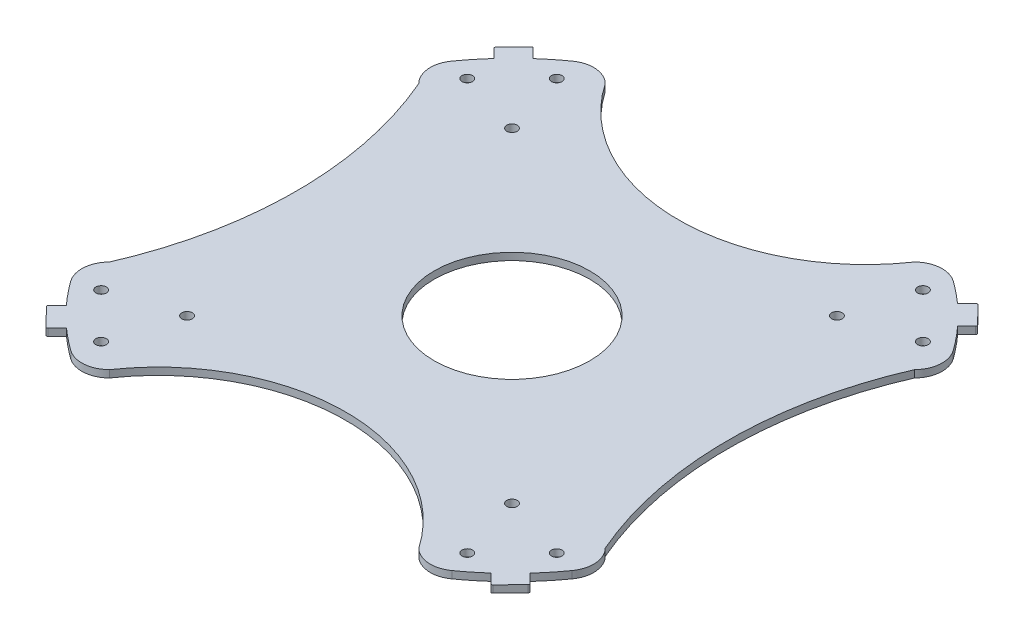
from build123d import *

# Parameters (mm, degrees)
SKETCH1_R           = 1.015999988
SKETCH1_R_2         = 15
BOSS_EXTRUDE1_DEPTH = 1.397


with BuildPart() as part:
    # Sketch1 → Boss-Extrude1 (new body)
    with BuildSketch(Plane(origin=(0, 0, 0), x_dir=(1, 0, 0), z_dir=(0, 1, 0))):
        with BuildLine():
            Line((-44.657487237, -41.209177315), (-46.396043567, -42.947733627))
            ThreePointArc((-46.396043567, -42.947733627), (-46.470434262, -43.125880964), (-46.398093323, -43.304870453))
            Line((-46.398093323, -43.304870453), (-43.050556802, -46.730153525))
            ThreePointArc((-43.050556802, -46.730153525), (-42.865374815, -46.831022568), (-42.667823867, -46.757262447))
            Line((-42.667823867, -46.757262447), (-40.871772634, -44.961211232))
            ThreePointArc((-40.871772634, -44.961211232), (-38.831009245, -46.687575098), (-36.702263685, -48.30420423))
            ThreePointArc((-36.702263685, -48.30420423), (-33.138347002, -49.294565873), (-29.78114627, -47.741658512))
            ThreePointArc((-29.78114627, -47.741658512), (0, -32.054645119), (29.78114627, -47.741658512))
            ThreePointArc((29.78114627, -47.741658512), (33.138347002, -49.294565873), (36.702263685, -48.30420423))
            ThreePointArc((36.702263685, -48.30420423), (38.831009245, -46.687575098), (40.871772634, -44.961211232))
            Line((40.871772634, -44.961211232), (42.667823867, -46.757262447))
            ThreePointArc((42.667823867, -46.757262447), (42.865374815, -46.831022568), (43.050556802, -46.730153525))
            Line((43.050556802, -46.730153525), (46.398093323, -43.304870453))
            ThreePointArc((46.398093323, -43.304870453), (46.470434262, -43.125880964), (46.396043567, -42.947733627))
            Line((46.396043567, -42.947733627), (44.657487237, -41.209177315))
            ThreePointArc((44.657487237, -41.209177315), (46.545191357, -39.007785017), (48.30420423, -36.702263685))
            ThreePointArc((48.30420423, -36.702263685), (49.294565905, -33.13834702), (47.741658512, -29.78114627))
            ThreePointArc((47.741658512, -29.78114627), (41.575395348, 0), (47.741658512, 29.78114627))
            ThreePointArc((47.741658512, 29.78114627), (49.294565905, 33.13834702), (48.30420423, 36.702263685))
            ThreePointArc((48.30420423, 36.702263685), (46.545191357, 39.007785017), (44.657487237, 41.209177315))
            Line((44.657487237, 41.209177315), (46.396043567, 42.947733627))
            ThreePointArc((46.396043567, 42.947733627), (46.470434262, 43.125880964), (46.398093323, 43.304870453))
            Line((46.398093323, 43.304870453), (43.050556802, 46.730153525))
            ThreePointArc((43.050556802, 46.730153525), (42.865374815, 46.831022568), (42.667823867, 46.757262447))
            Line((42.667823867, 46.757262447), (40.871772634, 44.961211232))
            ThreePointArc((40.871772634, 44.961211232), (38.831009245, 46.687575098), (36.702263685, 48.30420423))
            ThreePointArc((36.702263685, 48.30420423), (33.138347002, 49.294565873), (29.78114627, 47.741658512))
            ThreePointArc((29.78114627, 47.741658512), (0, 32.054645119), (-29.78114627, 47.741658512))
            ThreePointArc((-29.78114627, 47.741658512), (-33.138347002, 49.294565873), (-36.702263685, 48.30420423))
            ThreePointArc((-36.702263685, 48.30420423), (-38.831009245, 46.687575098), (-40.871772634, 44.961211232))
            Line((-40.871772634, 44.961211232), (-42.667823867, 46.757262447))
            ThreePointArc((-42.667823867, 46.757262447), (-42.865374815, 46.831022568), (-43.050556802, 46.730153525))
            Line((-43.050556802, 46.730153525), (-46.398093323, 43.304870453))
            ThreePointArc((-46.398093323, 43.304870453), (-46.470434262, 43.125880964), (-46.396043567, 42.947733627))
            Line((-46.396043567, 42.947733627), (-44.657487237, 41.209177315))
            ThreePointArc((-44.657487237, 41.209177315), (-46.545191357, 39.007785017), (-48.30420423, 36.702263685))
            ThreePointArc((-48.30420423, 36.702263685), (-49.294565905, 33.13834702), (-47.741658512, 29.78114627))
            ThreePointArc((-47.741658512, 29.78114627), (-41.575395348, 0), (-47.741658512, -29.78114627))
            ThreePointArc((-47.741658512, -29.78114627), (-49.294565905, -33.13834702), (-48.30420423, -36.702263685))
            ThreePointArc((-48.30420423, -36.702263685), (-46.545191357, -39.007785017), (-44.657487237, -41.209177315))
        make_face()
        with Locations(Location((-35.273880272, -43.89492624, 0), (0, 0, 90))):
            Circle(SKETCH1_R, mode=Mode.SUBTRACT)
        with Locations(Location((-43.894926149, -35.273880364, 0), (0, 0, 270))):
            Circle(SKETCH1_R, mode=Mode.SUBTRACT)
        with Locations(Location((-31.299173944, -31.299174035, 0), (0, 0, 270))):
            Circle(SKETCH1_R, mode=Mode.SUBTRACT)
        with Locations(Location((43.894926149, -35.273880364, 0), (0, 0, 90))):
            Circle(SKETCH1_R, mode=Mode.SUBTRACT)
        with Locations(Location((35.273880272, -43.89492624, 0), (0, 0, 270))):
            Circle(SKETCH1_R, mode=Mode.SUBTRACT)
        with Locations(Location((31.299173944, -31.299174035, 0), (0, 0, 90))):
            Circle(SKETCH1_R, mode=Mode.SUBTRACT)
        with Locations(Location((-35.273880272, 43.89492624, 0), (0, 0, 270))):
            Circle(SKETCH1_R, mode=Mode.SUBTRACT)
        with Locations(Location((-31.299173944, 31.299174035, 0), (0, 0, 90))):
            Circle(SKETCH1_R, mode=Mode.SUBTRACT)
        with Locations(Location((-43.894926149, 35.273880364, 0), (0, 0, 90))):
            Circle(SKETCH1_R, mode=Mode.SUBTRACT)
        with Locations(Location((43.894926149, 35.273880364, 0), (0, 0, 270))):
            Circle(SKETCH1_R, mode=Mode.SUBTRACT)
        with Locations(Location((35.273880272, 43.89492624, 0), (0, 0, 90))):
            Circle(SKETCH1_R, mode=Mode.SUBTRACT)
        with Locations(Location((31.299173944, 31.299174035, 0), (0, 0, 270))):
            Circle(SKETCH1_R, mode=Mode.SUBTRACT)
        with Locations(Location((0, 0, 0), (0, 0, 270))):
            Circle(SKETCH1_R_2, mode=Mode.SUBTRACT)
    extrude(amount=BOSS_EXTRUDE1_DEPTH)


solid = part.part
